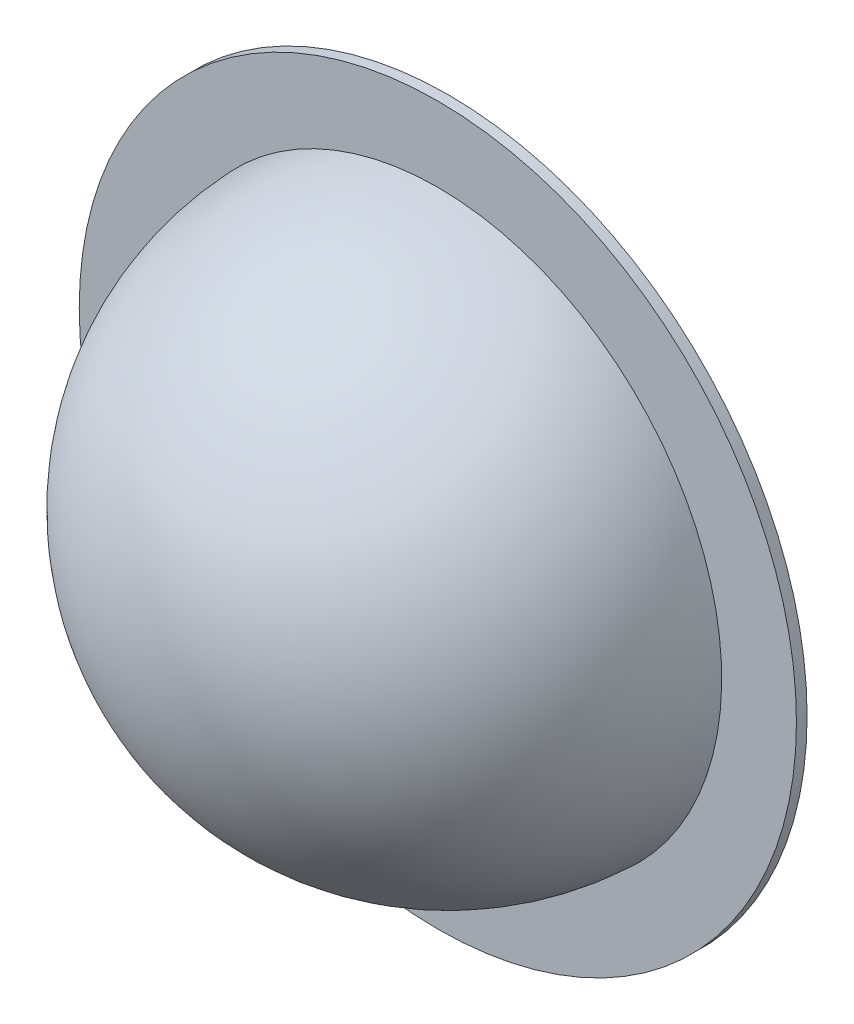
from build123d import *

# Parameters (mm, degrees)
SKETCH_2_R               = 101.541015805
CUT_EXTRUDE_1_DEPTH      = 92
SKETCH_4_R               = 60
SKETCH_4_R_2             = 39
EXTRUDE_1_DEPTH          = 1.5
SKETCH_5_W               = 2
SKETCH_5_H               = 2
CUT_EXTRUDE_2_DEPTH      = 94.808315196
CUT_EXTRUDE_2_DEPTH_BACK = 94.808315196
SKETCH_6_OUTSIDE_W       = 156.966
SKETCH_6_OUTSIDE_H       = 156.966
SKETCH_6_OUTSIDE_R       = 52.5
CUT_EXTRUDE_3_DEPTH      = 84.634622017
CUT_EXTRUDE_3_DEPTH_BACK = 84.634622017
SKETCH_7_OUTSIDE_W       = 137.864
SKETCH_7_OUTSIDE_H       = 137.864
SKETCH_7_OUTSIDE_R       = 50.5


with BuildPart() as part:
    # 草图1 → 旋转1 (revolve)
    with BuildSketch(Plane(origin=(0, 0, 0), x_dir=(0, 0, -1), z_dir=(1, 0, 0))):
        with BuildLine():
            Line((-40, 0), (40, 0))
            ThreePointArc((40, 0), (0, 40), (-40, 0))
        make_face()
    revolve(axis=Axis((0, 0, 40), (0, 0, -1)))

    # 草图2 → 切除-拉伸1 (cut)
    with BuildSketch(Plane.XY):
        with Locations((-18.762206379, 13.237665106)):
            Circle(SKETCH_2_R)
    extrude(amount=-CUT_EXTRUDE_1_DEPTH, mode=Mode.SUBTRACT)

    # 草图3 → 切除-旋转1 (revolve, cut)
    with BuildSketch(Plane(origin=(0, 0, 0), x_dir=(1, 0, 0), z_dir=(0, 1, 0))):
        with BuildLine():
            Line((0, 38.5), (0, -38.5))
            ThreePointArc((0, -38.5), (38.5, 0), (0, 38.5))
        make_face()
    revolve(axis=Axis((0, 0, -38.5), (0, 0, 1)), mode=Mode.SUBTRACT)

    # 草图4 → 凸台-拉伸1 (add)
    with BuildSketch(Plane(origin=(0, 0, 0), x_dir=(-1, 0, 0), z_dir=(0, 0, -1))):
        Circle(SKETCH_4_R)
        Circle(SKETCH_4_R_2, mode=Mode.SUBTRACT)
    extrude(amount=-EXTRUDE_1_DEPTH)

    # 草图5 → 旋转2 (revolve)
    with BuildSketch(Plane(origin=(0, 0, 0), x_dir=(1, 0, 0), z_dir=(0, 1, 0)), mode=Mode.PRIVATE) as revolve_2_sk:
        with Locations((-44, 1)):
            Rectangle(SKETCH_5_W, SKETCH_5_H)
    revolve(revolve_2_sk.sketch.rotate(Axis((0, 0, -24.660694069), (0, 0, 1)), 270), axis=Axis((0, 0, -24.660694069), (0, 0, 1)))

    # 草图6 outside → 切除-拉伸2 (cut, two sides: drawn at the far end of the back side and taken through both)
    with BuildSketch(Plane(origin=(0, 0, 0), x_dir=(-1, 0, 0), z_dir=(0, 0, -1)).offset(-CUT_EXTRUDE_2_DEPTH_BACK)):
        Rectangle(SKETCH_6_OUTSIDE_W, SKETCH_6_OUTSIDE_H)
        Circle(SKETCH_6_OUTSIDE_R, mode=Mode.SUBTRACT)
    extrude(amount=CUT_EXTRUDE_2_DEPTH + CUT_EXTRUDE_2_DEPTH_BACK, mode=Mode.SUBTRACT)

    # 草图7 outside → 切除-拉伸3 (cut, two sides: drawn at the far end of the back side and taken through both)
    with BuildSketch(Plane.XY.offset(1.5).offset(-CUT_EXTRUDE_3_DEPTH_BACK)):
        Rectangle(SKETCH_7_OUTSIDE_W, SKETCH_7_OUTSIDE_H)
        Circle(SKETCH_7_OUTSIDE_R, mode=Mode.SUBTRACT)
    extrude(amount=CUT_EXTRUDE_3_DEPTH + CUT_EXTRUDE_3_DEPTH_BACK, mode=Mode.SUBTRACT)


solid = part.part
